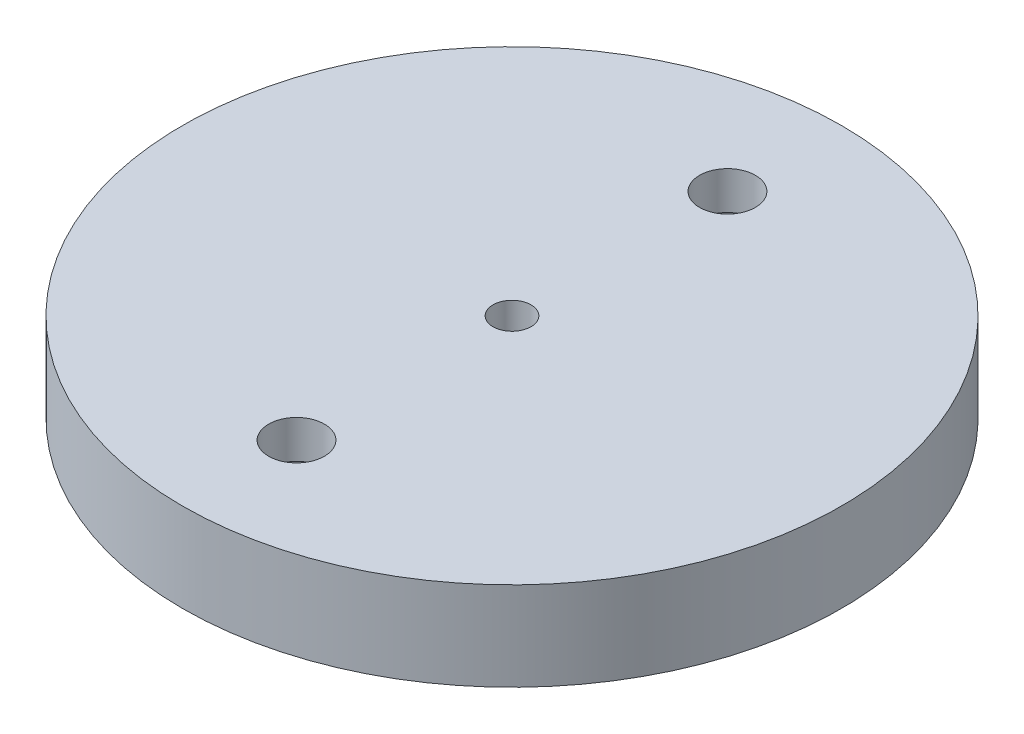
from build123d import *

# Parameters (mm, degrees)
SKETCH1_R           = 13
SKETCH1_R_2         = 1.65
SKETCH1_R_3         = 2.5
BOSS_EXTRUDE1_DEPTH = 2
SKETCH2_R           = 13
SKETCH2_R_2         = 0.75
SKETCH2_R_3         = 1.1
BOSS_EXTRUDE2_DEPTH = 1.5


with BuildPart() as part:
    # Sketch1 → Boss-Extrude1 (new body)
    with BuildSketch(Plane(origin=(0, 0, 0), x_dir=(1, 0, 0), z_dir=(0, 1, 0))):
        with Locations(Location((0, 0, 0), (0, 0, 270))):
            Circle(SKETCH1_R)
        with Locations(Location((0, 0, 0), (0, 0, 270))):
            Circle(SKETCH1_R_2, mode=Mode.SUBTRACT)
        with Locations(Location((0, 8.5, 0), (0, 0, 270))):
            Circle(SKETCH1_R_3, mode=Mode.SUBTRACT)
        with Locations(Location((0, -8.5, 0), (0, 0, 270))):
            Circle(SKETCH1_R_3, mode=Mode.SUBTRACT)
    extrude(amount=BOSS_EXTRUDE1_DEPTH)

    # Sketch2 → Boss-Extrude2 (add)
    with BuildSketch(Plane(origin=(0, 2, 0), x_dir=(1, 0, 0), z_dir=(0, 1, 0))):
        with Locations(Location((0, 0, 0), (0, 0, 270))):
            Circle(SKETCH2_R)
        with Locations(Location((0, 0, 0), (0, 0, 270))):
            Circle(SKETCH2_R_2, mode=Mode.SUBTRACT)
        with Locations(Location((0, 8.5, 0), (0, 0, 270))):
            Circle(SKETCH2_R_3, mode=Mode.SUBTRACT)
        with Locations(Location((0, -8.5, 0), (0, 0, 270))):
            Circle(SKETCH2_R_3, mode=Mode.SUBTRACT)
    extrude(amount=BOSS_EXTRUDE2_DEPTH)


solid = part.part
